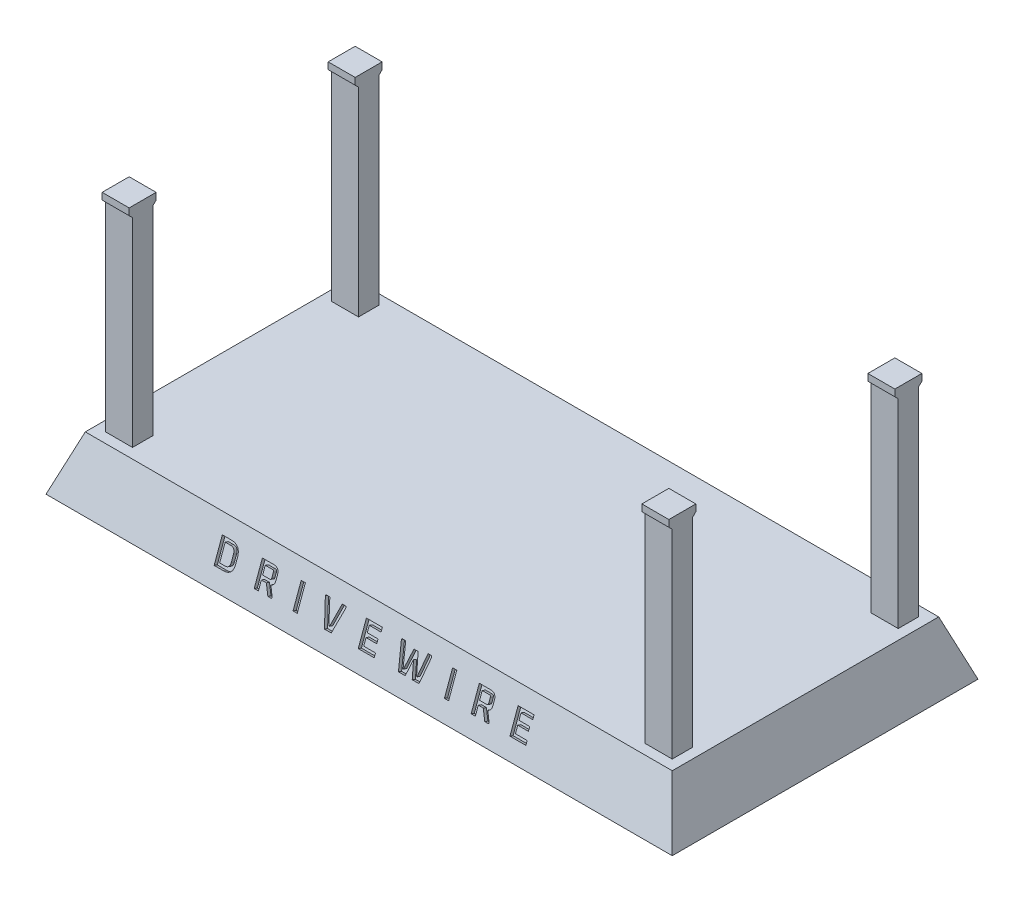
from build123d import *

# Parameters (mm, degrees)
SKETCH1_W           = 174
SKETCH1_H           = 79
BOSS_EXTRUDE1_DEPTH = 16
BOSS_EXTRUDE1_DRAFT = 20
SKETCH2_W           = 1.241975655
SKETCH2_H           = 7.071747504
CUT_EXTRUDE1_DEPTH  = 1
SKETCH3_W           = 8
SKETCH3_H           = 6
BOSS_EXTRUDE2_DEPTH = 60
SKETCH4_W           = 8
SKETCH4_H           = 8
BOSS_EXTRUDE4_DEPTH = 2
RIB12_REACH         = 194.782
SKETCH10_WALL_W     = 388.977595642
SKETCH10_WALL_H     = 8
RIB13_REACH         = 208.862
SKETCH11_WALL_W     = 1.414213562
SKETCH11_WALL_H     = 8
RIB14_REACH         = 208.862
SKETCH12_WALL_W     = 417.1376253
SKETCH12_WALL_H     = 8
RIB15_REACH         = 211.135
SKETCH13_WALL_W     = 421.685167084
SKETCH13_WALL_H     = 8
RIB16_REACH         = 194.782
SKETCH14_WALL_W     = 388.977595642
SKETCH14_WALL_H     = 8
RIB17_REACH         = 194.782
SKETCH15_WALL_W     = 1.414213562
SKETCH15_WALL_H     = 8
RIB18_REACH         = 194.782
SKETCH16_WALL_W     = 388.977595642
SKETCH16_WALL_H     = 8
RIB19_REACH         = 194.782
SKETCH17_WALL_W     = 388.977595642
SKETCH17_WALL_H     = 8


with BuildPart() as part:
    # Sketch1 → Boss-Extrude1 (with draft: the straight prism first)
    with BuildSketch(Plane(origin=(0, 0, 0), x_dir=(1, 0, 0), z_dir=(0, 1, 0))):
        Rectangle(SKETCH1_W, SKETCH1_H)
    extrude(amount=-BOSS_EXTRUDE1_DEPTH)
    # Boss-Extrude1: the draft: its side faces are tilted about the plane it starts from
    boss_extrude1_sides = [part.faces().sort_by_distance(p)[0] for p in [
        (0, -8, 39.5),
        (87, -8, 0),
        (0, -8, -39.5),
        (-87, -8, 0),
    ]]
    draft(boss_extrude1_sides, Plane(origin=(0, 0, 0), x_dir=(1, 0, 0), z_dir=(0, 1, 0)), BOSS_EXTRUDE1_DRAFT)

    # Sketch2 → Cut-Extrude1 (cut)
    # profile 1 of 9: a face of its own
    with BuildSketch(Plane(origin=(0, 12.695055291, 34.879377752), x_dir=(1, 0, 0), z_dir=(0, 0.34202014332566905, 0.9396926207859083))):
        with BuildLine():
            Line((-44.746173, -25.356770763), (-44.746173, -18.285023259))
            Line((-44.746173, -18.285023259), (-42.048595983, -18.285023259))
            add(Edge.make_bspline(
                [(-42.048595983, -18.285023259), (-41.937521817, -18.286746328), (-41.722233477, -18.29008605), (-41.409907449, -18.323115422), (-41.118822018, -18.376465585), (-40.849192409, -18.453587273), (-40.600103007, -18.549959583), (-40.372666244, -18.670153216), (-40.166905031, -18.812026849), (-39.982107036, -18.975146147), (-39.820558549, -19.16144983), (-39.679667145, -19.36892025), (-39.56188839, -19.59878086), (-39.46612035, -19.84994938), (-39.391376087, -20.122370579), (-39.337289391, -20.416558905), (-39.304635826, -20.73238423), (-39.301214763, -20.950107784), (-39.299454141, -21.062157435)],
                knots=[0, 0, 0, 0, 1.188713315, 2.304011127, 3.357802465, 4.352913975, 5.301847974, 6.21197883, 7.100084463, 7.971523922, 8.843438996, 9.732912908, 10.649926474, 11.601855752, 12.605664396, 13.669791362, 14.800777136, 16, 16, 16, 16], degree=3))
            Line((-39.299454141, -21.062157435), (-39.299454141, -22.579636587))
            add(Edge.make_bspline(
                [(-39.299454141, -22.579636587), (-39.301214763, -22.691686238), (-39.304635826, -22.909409792), (-39.337289391, -23.225235118), (-39.391376087, -23.519423443), (-39.46612035, -23.791844642), (-39.56188839, -24.043013162), (-39.679667145, -24.272873772), (-39.820558549, -24.480344192), (-39.982107036, -24.666647875), (-40.166905031, -24.829767173), (-40.372666244, -24.971640806), (-40.600103007, -25.091834439), (-40.849192409, -25.188206749), (-41.118822018, -25.265328437), (-41.409907449, -25.3186786), (-41.722233477, -25.351707972), (-41.937521817, -25.355047694), (-42.048595983, -25.356770763)],
                knots=[0, 0, 0, 0, 1.199222864, 2.330208638, 3.394335604, 4.398144248, 5.350073526, 6.267087092, 7.156561004, 8.028476078, 8.899915537, 9.78802117, 10.698152026, 11.647086025, 12.642197535, 13.695988873, 14.811286685, 16, 16, 16, 16], degree=3))
            Line((-42.048595983, -25.356770763), (-44.746173, -25.356770763))
        make_face()
        with BuildLine():
            Line((-43.504197344, -24.226764443), (-41.976405227, -24.226764443))
            add(Edge.make_bspline(
                [(-41.976405227, -24.226764443), (-41.918427314, -24.225529877), (-41.806163812, -24.223139368), (-41.642850611, -24.20767543), (-41.491210277, -24.177873775), (-41.350216977, -24.13808609), (-41.219836166, -24.088601314), (-41.100981757, -24.026494835), (-40.993786701, -23.951998132), (-40.897874095, -23.866371752), (-40.812667128, -23.769791892), (-40.740458234, -23.660781277), (-40.677988693, -23.541028906), (-40.628768384, -23.409075643), (-40.58859948, -23.267290051), (-40.560780904, -23.113886437), (-40.545011572, -22.949273845), (-40.542645948, -22.835530784), (-40.541429796, -22.777056205)],
                knots=[0, 0, 0, 0, 1.189055845, 2.302386679, 3.359069874, 4.353701447, 5.3037939, 6.213754028, 7.096558538, 7.973888864, 8.844546497, 9.729989503, 10.648878363, 11.608371854, 12.612694507, 13.667504363, 14.800878928, 16, 16, 16, 16], degree=3))
            Line((-40.541429796, -22.777056205), (-40.541429796, -20.864737817))
            add(Edge.make_bspline(
                [(-40.541429796, -20.864737817), (-40.542651986, -20.806265082), (-40.545029353, -20.692525609), (-40.560716218, -20.527887826), (-40.588904632, -20.374105348), (-40.628152841, -20.232018744), (-40.678388042, -20.100426002), (-40.740410583, -19.980994732), (-40.812680391, -19.872009323), (-40.897867105, -19.775411027), (-40.993801571, -19.689834152), (-41.100928298, -19.615154704), (-41.220205067, -19.553678119), (-41.349596554, -19.501366094), (-41.491544277, -19.464569493), (-41.642791448, -19.433923238), (-41.806180125, -19.418708521), (-41.91843287, -19.41628249), (-41.976405227, -19.415029579)],
                knots=[0, 0, 0, 0, 1.199026098, 2.332310896, 3.387037208, 4.400978033, 5.350995236, 6.269811316, 7.155184193, 8.025772867, 8.903033706, 9.785768295, 10.695656352, 11.649349095, 12.641196174, 13.697795677, 14.811038332, 16, 16, 16, 16], degree=3))
            Line((-41.976405227, -19.415029579), (-43.504197344, -19.415029579))
            Line((-43.504197344, -19.415029579), (-43.504197344, -24.226764443))
        make_face(mode=Mode.SUBTRACT)
    # profile 2 of 9: a face of its own
    with BuildSketch(Plane(origin=(0, 12.695055291, 34.879377752), x_dir=(1, 0, 0), z_dir=(0, 0.34202014332566905, 0.9396926207859083))):
        with BuildLine():
            Line((-32.865637192, -25.356770763), (-32.865637192, -18.285023259))
            Line((-32.865637192, -18.285023259), (-29.485931198, -18.285023259))
            add(Edge.make_bspline(
                [(-29.485931198, -18.285023259), (-29.419077589, -18.285807386), (-29.288955058, -18.287333595), (-29.10044443, -18.309100683), (-28.924357568, -18.340633936), (-28.760942307, -18.385599439), (-28.611627593, -18.447225108), (-28.473586922, -18.518207548), (-28.350077736, -18.60531889), (-28.238512205, -18.704009778), (-28.14151143, -18.817457172), (-28.0540635, -18.941557024), (-27.984584523, -19.081947974), (-27.924563242, -19.233807431), (-27.881757731, -19.399850322), (-27.849344523, -19.578050411), (-27.827921938, -19.769082449), (-27.826350757, -19.901153006), (-27.825543815, -19.968983133)],
                knots=[0, 0, 0, 0, 1.182087601, 2.300791764, 3.352191054, 4.345104074, 5.292142859, 6.205423244, 7.085151355, 7.958895877, 8.83341756, 9.720281201, 10.637273285, 11.597255171, 12.604621065, 13.664564823, 14.800543674, 16, 16, 16, 16], degree=3))
            Line((-27.825543815, -19.968983133), (-27.825543815, -21.137294752))
            add(Edge.make_bspline(
                [(-27.825543815, -21.137294752), (-27.826437956, -21.190358538), (-27.82817883, -21.293672645), (-27.840379896, -21.444625567), (-27.858738544, -21.588001867), (-27.887086295, -21.72320593), (-27.921650529, -21.850695691), (-27.966675172, -21.969016974), (-28.017793047, -22.080439365), (-28.078715732, -22.183564762), (-28.146211863, -22.279576261), (-28.221649513, -22.367535433), (-28.306481925, -22.445544351), (-28.39818821, -22.516443474), (-28.497182368, -22.580719012), (-28.605483618, -22.634316214), (-28.720685549, -22.682773731), (-28.802045288, -22.706177142), (-28.843580799, -22.718124976)],
                knots=[0, 0, 0, 0, 1.245139748, 2.424261664, 3.552145235, 4.634785591, 5.663774039, 6.648438548, 7.602271101, 8.537187548, 9.454898112, 10.353671205, 11.250669234, 12.154305774, 13.071799223, 14.014989741, 14.986618954, 16, 16, 16, 16], degree=3))
            Line((-28.843580799, -22.718124976), (-27.622231074, -25.094526793))
            Line((-27.622231074, -25.094526793), (-27.773978989, -25.356770763))
            Line((-27.773978989, -25.356770763), (-28.833267834, -25.356770763))
            Line((-28.833267834, -25.356770763), (-30.13712128, -22.809468381))
            Line((-30.13712128, -22.809468381), (-31.623661537, -22.809468381))
            Line((-31.623661537, -22.809468381), (-31.623661537, -25.356770763))
            Line((-31.623661537, -25.356770763), (-32.865637192, -25.356770763))
        make_face()
        with BuildLine():
            Line((-31.623661537, -21.679462061), (-29.515396812, -21.679462061))
            add(Edge.make_bspline(
                [(-29.515396812, -21.679462061), (-29.480390122, -21.67824501), (-29.41400998, -21.675937221), (-29.321598216, -21.653622852), (-29.242205942, -21.618190148), (-29.176724472, -21.567065798), (-29.127152307, -21.499486686), (-29.091491641, -21.41812775), (-29.071598733, -21.322388155), (-29.068928374, -21.254266658), (-29.06751947, -21.218325192)],
                knots=[0, 0, 0, 0, 1.139197889, 2.160161876, 3.076811787, 3.954193982, 4.834491076, 5.780300629, 6.828868231, 8, 8, 8, 8], degree=3))
            Line((-29.06751947, -21.218325192), (-29.06751947, -19.865853482))
            add(Edge.make_bspline(
                [(-29.06751947, -19.865853482), (-29.068910627, -19.830410859), (-29.071526934, -19.763754959), (-29.09130531, -19.670240161), (-29.128056011, -19.591573531), (-29.176183728, -19.524306913), (-29.242790063, -19.475153236), (-29.321304549, -19.438889909), (-29.414274083, -19.419120386), (-29.480442698, -19.416443608), (-29.515396812, -19.415029579)],
                knots=[0, 0, 0, 0, 1.168286561, 2.197162201, 3.124224936, 4.014521899, 4.891922844, 5.818985579, 6.84786122, 8, 8, 8, 8], degree=3))
            Line((-29.515396812, -19.415029579), (-31.623661537, -19.415029579))
            Line((-31.623661537, -19.415029579), (-31.623661537, -21.679462061))
        make_face(mode=Mode.SUBTRACT)
    # profile 3 of 9: a face of its own
    with BuildSketch(Plane(origin=(0, 12.695055291, 34.879377752), x_dir=(1, 0, 0), z_dir=(0, 0.34202014332566905, 0.9396926207859083))):
        with Locations((-20.741273425, -21.820897011)):
            Rectangle(SKETCH2_W, SKETCH2_H)
    # profile 4 of 9: a face of its own
    with BuildSketch(Plane(origin=(0, 12.695055291, 34.879377752), x_dir=(1, 0, 0), z_dir=(0, 0.34202014332566905, 0.9396926207859083))):
        Polygon((-14.115193341, -18.531061141), (-13.95165918, -18.285023259), (-12.871744405, -18.285023259), (-11.130326582, -24.226764443), (-10.937326806, -24.226764443), (-9.195908983, -18.285023259), (-8.107154524, -18.285023259), (-7.953933328, -18.531061141), (-10.031259157, -25.356770763), (-12.048180477, -25.356770763), align=None)
    # profile 5 of 9: a face of its own
    with BuildSketch(Plane(origin=(0, 12.695055291, 34.879377752), x_dir=(1, 0, 0), z_dir=(0, 0.34202014332566905, 0.9396926207859083))):
        Polygon((-2.032818074, -25.356770763), (-2.032818074, -18.285023259), (2.691993228, -18.285023259), (2.691993228, -19.415029579), (-0.790842418, -19.404716614), (-0.790842418, -21.125508506), (2.385550836, -21.135821472), (2.385550836, -22.255514826), (-0.790842418, -22.245201861), (-0.790842418, -24.226764443), (2.691993228, -24.237077408), (2.691993228, -25.356770763), align=None)
    # profile 6 of 9: a face of its own
    with BuildSketch(Plane(origin=(0, 12.695055291, 34.879377752), x_dir=(1, 0, 0), z_dir=(0, 0.34202014332566905, 0.9396926207859083))):
        Polygon((8.42747511, -18.531061141), (8.601322236, -18.285023259), (9.619359221, -18.285023259), (10.871647841, -24.226764443), (10.983617177, -24.226764443), (12.318409518, -19.002510974), (13.550072208, -19.002510974), (14.874551585, -24.226764443), (14.996833885, -24.226764443), (16.249122506, -18.285023259), (17.26715949, -18.285023259), (17.441006617, -18.531061141), (15.983931975, -25.356770763), (13.97732362, -25.356770763), (12.929821021, -21.196225982), (11.891158106, -25.356770763), (9.894862717, -25.356770763), align=None)
    # profile 7 of 9: a face of its own
    with BuildSketch(Plane(origin=(0, 12.695055291, 34.879377752), x_dir=(1, 0, 0), z_dir=(0, 0.34202014332566905, 0.9396926207859083))):
        with Locations((24.140750737, -21.820897011)):
            Rectangle(SKETCH2_W, SKETCH2_H)
    # profile 8 of 9: a face of its own
    with BuildSketch(Plane(origin=(0, 12.695055291, 34.879377752), x_dir=(1, 0, 0), z_dir=(0, 0.34202014332566905, 0.9396926207859083))):
        with BuildLine():
            Line((31.440120114, -25.356770763), (31.440120114, -18.285023259))
            Line((31.440120114, -18.285023259), (34.819826108, -18.285023259))
            add(Edge.make_bspline(
                [(34.819826108, -18.285023259), (34.886679717, -18.285807386), (35.016802249, -18.287333595), (35.205312876, -18.309100683), (35.381399738, -18.340633936), (35.544814999, -18.385599439), (35.694129713, -18.447225108), (35.832170384, -18.518207548), (35.955679571, -18.60531889), (36.067245101, -18.704009778), (36.164245876, -18.817457172), (36.251693806, -18.941557024), (36.321172783, -19.081947974), (36.381194064, -19.233807431), (36.423999575, -19.399850322), (36.456412783, -19.578050411), (36.477835368, -19.769082449), (36.479406549, -19.901153006), (36.480213491, -19.968983133)],
                knots=[0, 0, 0, 0, 1.182087601, 2.300791764, 3.352191054, 4.345104074, 5.292142859, 6.205423244, 7.085151355, 7.958895877, 8.83341756, 9.720281201, 10.637273285, 11.597255171, 12.604621065, 13.664564823, 14.800543674, 16, 16, 16, 16], degree=3))
            Line((36.480213491, -19.968983133), (36.480213491, -21.137294752))
            add(Edge.make_bspline(
                [(36.480213491, -21.137294752), (36.47931935, -21.190358538), (36.477578476, -21.293672645), (36.46537741, -21.444625567), (36.447018762, -21.588001867), (36.418671011, -21.72320593), (36.384106777, -21.850695691), (36.339082134, -21.969016974), (36.287964259, -22.080439365), (36.227041574, -22.183564762), (36.159545443, -22.279576261), (36.084107793, -22.367535433), (35.999275381, -22.445544351), (35.907569096, -22.516443474), (35.808574938, -22.580719012), (35.700273688, -22.634316214), (35.585071757, -22.682773731), (35.503712018, -22.706177142), (35.462176507, -22.718124976)],
                knots=[0, 0, 0, 0, 1.245139748, 2.424261664, 3.552145235, 4.634785591, 5.663774039, 6.648438548, 7.602271101, 8.537187548, 9.454898112, 10.353671205, 11.250669234, 12.154305774, 13.071799223, 14.014989741, 14.986618954, 16, 16, 16, 16], degree=3))
            Line((35.462176507, -22.718124976), (36.683526232, -25.094526793))
            Line((36.683526232, -25.094526793), (36.531778317, -25.356770763))
            Line((36.531778317, -25.356770763), (35.472489472, -25.356770763))
            Line((35.472489472, -25.356770763), (34.168636026, -22.809468381))
            Line((34.168636026, -22.809468381), (32.682095769, -22.809468381))
            Line((32.682095769, -22.809468381), (32.682095769, -25.356770763))
            Line((32.682095769, -25.356770763), (31.440120114, -25.356770763))
        make_face()
        with BuildLine():
            Line((32.682095769, -21.679462061), (34.790360494, -21.679462061))
            add(Edge.make_bspline(
                [(34.790360494, -21.679462061), (34.825367184, -21.67824501), (34.891747327, -21.675937221), (34.98415909, -21.653622852), (35.063551364, -21.618190148), (35.129032834, -21.567065798), (35.178604999, -21.499486686), (35.214265665, -21.41812775), (35.234158573, -21.322388155), (35.236828932, -21.254266658), (35.238237836, -21.218325192)],
                knots=[0, 0, 0, 0, 1.139197889, 2.160161876, 3.076811787, 3.954193982, 4.834491076, 5.780300629, 6.828868231, 8, 8, 8, 8], degree=3))
            Line((35.238237836, -21.218325192), (35.238237836, -19.865853482))
            add(Edge.make_bspline(
                [(35.238237836, -19.865853482), (35.236846679, -19.830410859), (35.234230372, -19.763754959), (35.214451996, -19.670240161), (35.177701295, -19.591573531), (35.129573579, -19.524306913), (35.062967243, -19.475153236), (34.984452758, -19.438889909), (34.891483223, -19.419120386), (34.825314608, -19.416443608), (34.790360494, -19.415029579)],
                knots=[0, 0, 0, 0, 1.168286561, 2.197162201, 3.124224936, 4.014521899, 4.891922844, 5.818985579, 6.84786122, 8, 8, 8, 8], degree=3))
            Line((34.790360494, -19.415029579), (32.682095769, -19.415029579))
            Line((32.682095769, -19.415029579), (32.682095769, -21.679462061))
        make_face(mode=Mode.SUBTRACT)
    # profile 9 of 9: a face of its own
    with BuildSketch(Plane(origin=(0, 12.695055291, 34.879377752), x_dir=(1, 0, 0), z_dir=(0, 0.34202014332566905, 0.9396926207859083))):
        Polygon((42.943496054, -25.356770763), (42.943496054, -18.285023259), (47.668307355, -18.285023259), (47.668307355, -19.415029579), (44.18547171, -19.404716614), (44.18547171, -21.125508506), (47.361864964, -21.135821472), (47.361864964, -22.255514826), (44.18547171, -22.245201861), (44.18547171, -24.226764443), (47.668307355, -24.237077408), (47.668307355, -25.356770763), align=None)
    extrude(amount=-CUT_EXTRUDE1_DEPTH, mode=Mode.SUBTRACT)

    # Sketch3 → Boss-Extrude2 (add)
    with BuildSketch(Plane(origin=(0, 0, 0), x_dir=(1, 0, 0), z_dir=(0, 1, 0))):
        with Locations((-80, -33.5)):
            Rectangle(SKETCH3_W, SKETCH3_H)
        with Locations((-80, 33.5)):
            Rectangle(SKETCH3_W, SKETCH3_H)
        with Locations((80, -33.5)):
            Rectangle(SKETCH3_W, SKETCH3_H)
        with Locations((80, 33.5)):
            Rectangle(SKETCH3_W, SKETCH3_H)
    extrude(amount=BOSS_EXTRUDE2_DEPTH)

    # Sketch4 → Boss-Extrude4 (add)
    with BuildSketch(Plane(origin=(0, 60, 0), x_dir=(1, 0, 0), z_dir=(0, 1, 0))):
        with Locations((-80, -33.5)):
            Rectangle(SKETCH4_W, SKETCH4_H)
        with Locations((-80, 33.5)):
            Rectangle(SKETCH4_W, SKETCH4_H)
        with Locations((80, -33.5)):
            Rectangle(SKETCH4_W, SKETCH4_H)
        with Locations((80, 33.5)):
            Rectangle(SKETCH4_W, SKETCH4_H)
    extrude(amount=BOSS_EXTRUDE4_DEPTH)

    # Sketch10 wall → Rib12 (add, up to next)
    with BuildSketch(Plane(origin=(84, 59.5, 37), x_dir=(0, -0.707106781187, -0.707106781187), z_dir=(0, 0.707106781187, -0.707106781187)), mode=Mode.PRIVATE) as rib12_sk1:
        with Locations((0, 4)):
            Rectangle(SKETCH10_WALL_W, SKETCH10_WALL_H)
    rib12_tool1 = extrude(rib12_sk1.sketch, amount=RIB12_REACH, mode=Mode.PRIVATE) - part.part
    add(rib12_tool1.solids().sort_by_distance((84, 59.5, 37))[0])

    # Sketch11 wall → Rib13 (add, up to next)
    with BuildSketch(Plane(origin=(84, 59.5, 30), x_dir=(0, -0.707106781187, 0.707106781187), z_dir=(0, -0.707106781187, -0.707106781187)), mode=Mode.PRIVATE) as rib13_sk1:
        with Locations((0, 4)):
            Rectangle(SKETCH11_WALL_W, SKETCH11_WALL_H)
    rib13_tool1 = extrude(rib13_sk1.sketch, amount=-RIB13_REACH, mode=Mode.PRIVATE) - part.part
    add(rib13_tool1.solids().sort_by_distance((84, 59.5, 30))[0])

    # Sketch12 wall → Rib14 (add, up to next)
    with BuildSketch(Plane(origin=(84, 59.5, -30), x_dir=(0, -0.707106781187, -0.707106781187), z_dir=(0, 0.707106781187, -0.707106781187)), mode=Mode.PRIVATE) as rib14_sk1:
        with Locations((0, 4)):
            Rectangle(SKETCH12_WALL_W, SKETCH12_WALL_H)
    rib14_tool1 = extrude(rib14_sk1.sketch, amount=RIB14_REACH, mode=Mode.PRIVATE) - part.part
    add(rib14_tool1.solids().sort_by_distance((84, 59.5, -30))[0])

    # Sketch13 wall → Rib15 (add, up to next)
    with BuildSketch(Plane(origin=(84, 59.5, -37), x_dir=(0, -0.707106781187, 0.707106781187), z_dir=(0, -0.707106781187, -0.707106781187)), mode=Mode.PRIVATE) as rib15_sk1:
        with Locations((0, 4)):
            Rectangle(SKETCH13_WALL_W, SKETCH13_WALL_H)
    rib15_tool1 = extrude(rib15_sk1.sketch, amount=-RIB15_REACH, mode=Mode.PRIVATE) - part.part
    add(rib15_tool1.solids().sort_by_distance((84, 59.5, -37))[0])

    # Sketch14 wall → Rib16 (add, up to next)
    with BuildSketch(Plane(origin=(-84, 59.5, -37), x_dir=(0, -0.707106781187, 0.707106781187), z_dir=(0, 0.707106781187, 0.707106781187)), mode=Mode.PRIVATE) as rib16_sk1:
        with Locations((0, 4)):
            Rectangle(SKETCH14_WALL_W, SKETCH14_WALL_H)
    rib16_tool1 = extrude(rib16_sk1.sketch, amount=RIB16_REACH, mode=Mode.PRIVATE) - part.part
    add(rib16_tool1.solids().sort_by_distance((-84, 59.5, -37))[0])

    # Sketch15 wall → Rib17 (add, up to next)
    with BuildSketch(Plane(origin=(-84, 59.5, -30), x_dir=(0, -0.707106781187, -0.707106781187), z_dir=(0, -0.707106781187, 0.707106781187)), mode=Mode.PRIVATE) as rib17_sk1:
        with Locations((0, 4)):
            Rectangle(SKETCH15_WALL_W, SKETCH15_WALL_H)
    rib17_tool1 = extrude(rib17_sk1.sketch, amount=-RIB17_REACH, mode=Mode.PRIVATE) - part.part
    add(rib17_tool1.solids().sort_by_distance((-84, 59.5, -30))[0])

    # Sketch16 wall → Rib18 (add, up to next)
    with BuildSketch(Plane(origin=(-84, 59.5, 30), x_dir=(0, -0.707106781187, 0.707106781187), z_dir=(0, 0.707106781187, 0.707106781187)), mode=Mode.PRIVATE) as rib18_sk1:
        with Locations((0, 4)):
            Rectangle(SKETCH16_WALL_W, SKETCH16_WALL_H)
    rib18_tool1 = extrude(rib18_sk1.sketch, amount=RIB18_REACH, mode=Mode.PRIVATE) - part.part
    add(rib18_tool1.solids().sort_by_distance((-84, 59.5, 30))[0])

    # Sketch17 wall → Rib19 (add, up to next)
    with BuildSketch(Plane(origin=(-84, 59.5, 37), x_dir=(0, -0.707106781187, -0.707106781187), z_dir=(0, -0.707106781187, 0.707106781187)), mode=Mode.PRIVATE) as rib19_sk1:
        with Locations((0, 4)):
            Rectangle(SKETCH17_WALL_W, SKETCH17_WALL_H)
    rib19_tool1 = extrude(rib19_sk1.sketch, amount=-RIB19_REACH, mode=Mode.PRIVATE) - part.part
    add(rib19_tool1.solids().sort_by_distance((-84, 59.5, 37))[0])


solid = part.part
